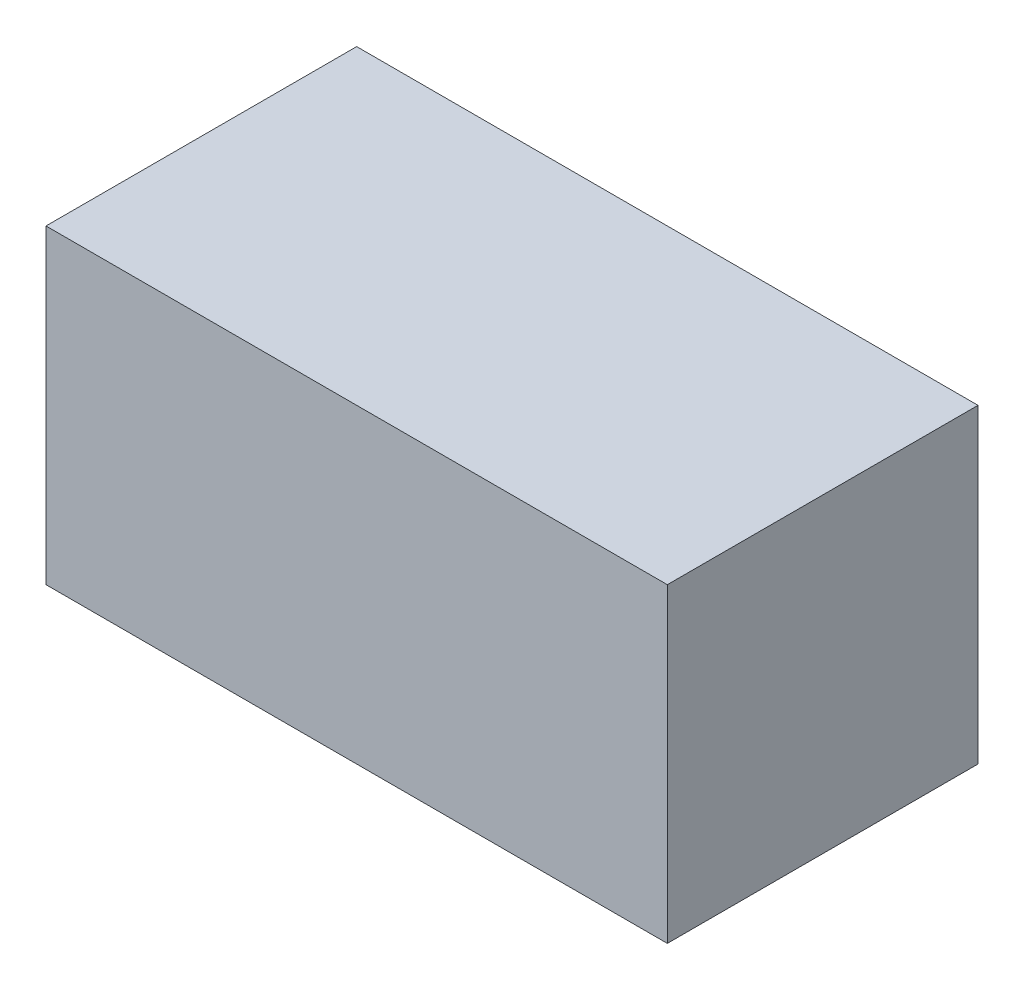
from build123d import *

# Parameters (mm, degrees)
BOSS_EXTRUDE1_DEPTH = 45


with BuildPart() as part:
    # Sketch1 → Boss-Extrude1 (new body)
    with BuildSketch(Plane(origin=(0, 0, 0), x_dir=(1, 0, 0), z_dir=(0, 1, 0))):
        Polygon((0, 0), (-45, 0), (-45, 45), (9.672897196, 45), (45, 45), (45, 0), align=None)
    extrude(amount=BOSS_EXTRUDE1_DEPTH)


solid = part.part
